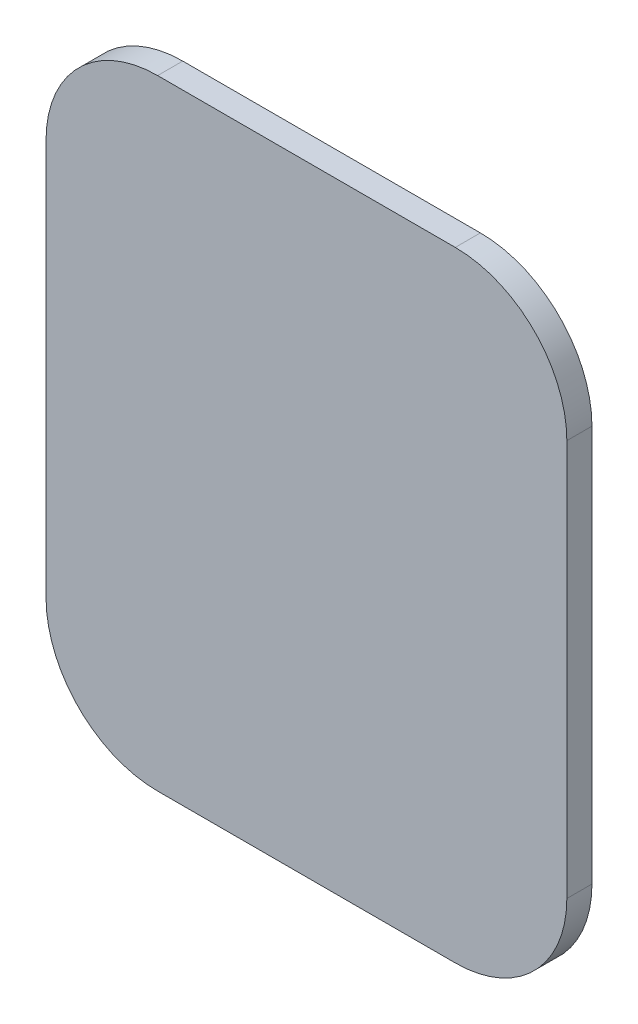
from build123d import *

# Parameters (mm, degrees)
SKETCH_2_W      = 37.34
SKETCH_2_H      = 44.43
EXTRUDE_1_DEPTH = 1.8
SKETCH_4_W      = 31
SKETCH_4_H      = 35
EXTRUDE_3_DEPTH = 1.89
FILLET_1_R      = 8
FILLET_2_R      = 8


with BuildPart() as part:
    # 草图2 → 凸台-拉伸1 (new body)
    with BuildSketch(Plane.XY):
        Rectangle(SKETCH_2_W, SKETCH_2_H)
    extrude(amount=EXTRUDE_1_DEPTH)

    # 草图4 → 凸台-拉伸3 (add)
    with BuildSketch(Plane(origin=(0, 0, 0), x_dir=(-1, 0, 0), z_dir=(0, 0, -1))):
        Rectangle(SKETCH_4_W, SKETCH_4_H)
    extrude(amount=EXTRUDE_3_DEPTH)

    # 圆角1
    fillet_1_edges = [part.edges().sort_by_distance(p)[0] for p in [
        (18.67, -22.215, 0.9),
        (-18.67, -22.215, 0.9),
        (-18.67, 22.215, 0.9),
        (18.67, 22.215, 0.9),
    ]]
    fillet(fillet_1_edges, radius=FILLET_1_R)

    # 圆角2
    fillet_2_edges = [part.edges().sort_by_distance(p)[0] for p in [
        (15.5, -17.5, -0.945),
        (-15.5, -17.5, -0.945),
        (-15.5, 17.5, -0.945),
        (15.5, 17.5, -0.945),
    ]]
    fillet(fillet_2_edges, radius=FILLET_2_R)


solid = part.part
